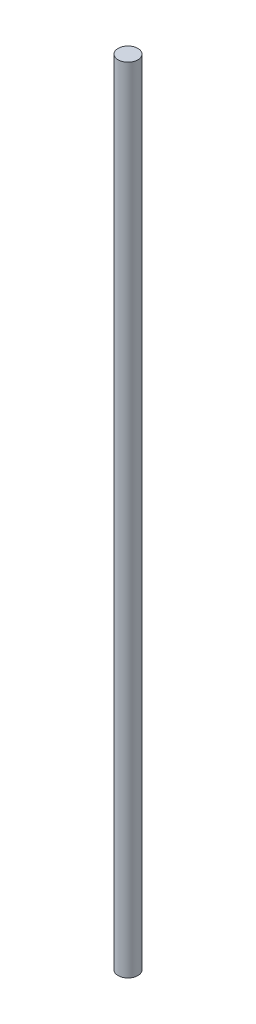
from build123d import *

# Parameters (mm, degrees)
SKETCH1_R           = 2.5
BOSS_EXTRUDE1_DEPTH = 100


with BuildPart() as part:
    # Sketch1 → Boss-Extrude1 (new, symmetric)
    with BuildSketch(Plane(origin=(0, 0, 0), x_dir=(1, 0, 0), z_dir=(0, 1, 0))):
        with Locations(Location((0, 0, 0), (0, 0, 270))):
            Circle(SKETCH1_R)
    extrude(amount=BOSS_EXTRUDE1_DEPTH, both=True)


solid = part.part
